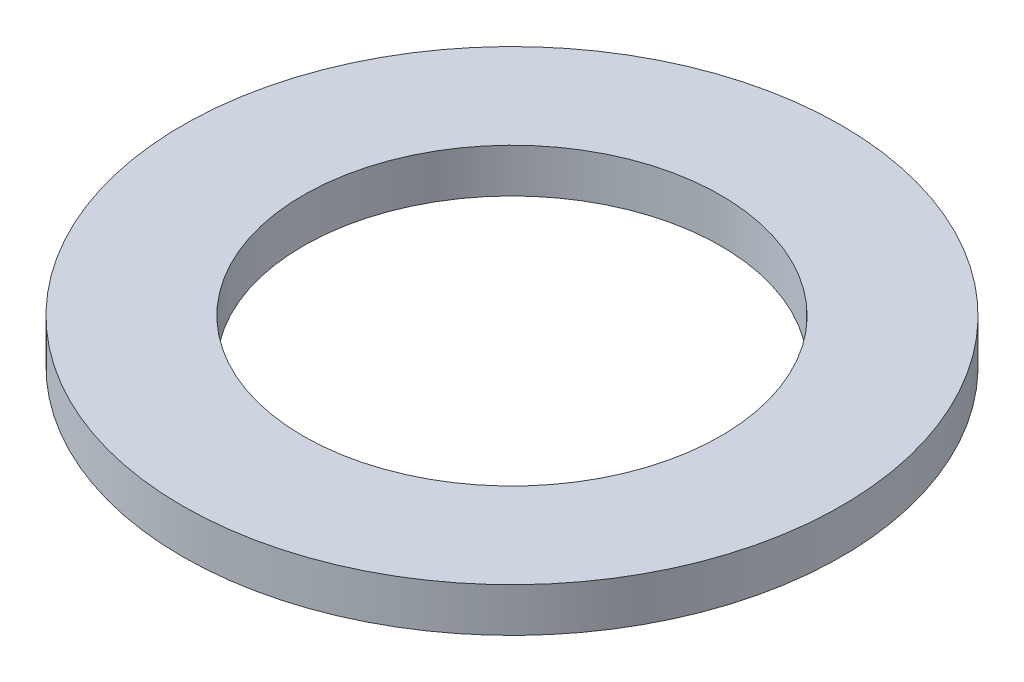
from build123d import *

# Parameters (mm, degrees)
SKETCH1_R           = 15
SKETCH1_R_2         = 9.5
BOSS_EXTRUDE1_DEPTH = 2


with BuildPart() as part:
    # Sketch1 → Boss-Extrude1 (new body)
    with BuildSketch(Plane(origin=(0, 0, 0), x_dir=(1, 0, 0), z_dir=(0, 1, 0))):
        with Locations(Location((0, 0, 0), (0, 0, 270))):
            Circle(SKETCH1_R)
        with Locations(Location((0, 0, 0), (0, 0, 270))):
            Circle(SKETCH1_R_2, mode=Mode.SUBTRACT)
    extrude(amount=BOSS_EXTRUDE1_DEPTH)


solid = part.part
